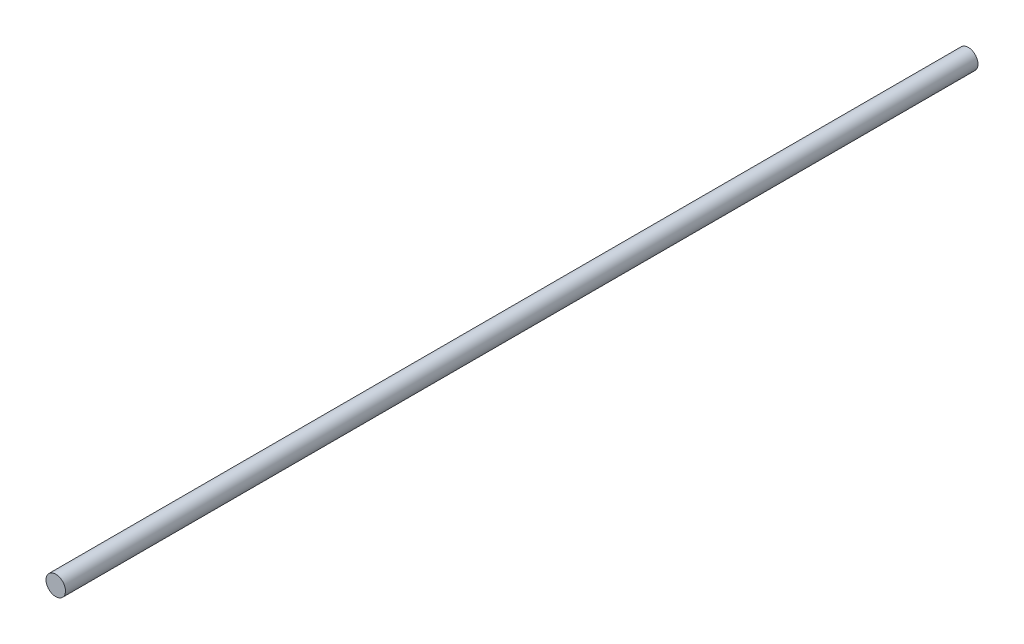
from build123d import *

# Parameters (mm, degrees)
CROQUIS1_R              = 4.5
SALIENTE_EXTRUIR1_DEPTH = 421.64


with BuildPart() as part:
    # Croquis1 → Saliente-Extruir1 (new body)
    with BuildSketch(Plane.XY):
        Circle(CROQUIS1_R)
    extrude(amount=SALIENTE_EXTRUIR1_DEPTH)


solid = part.part
